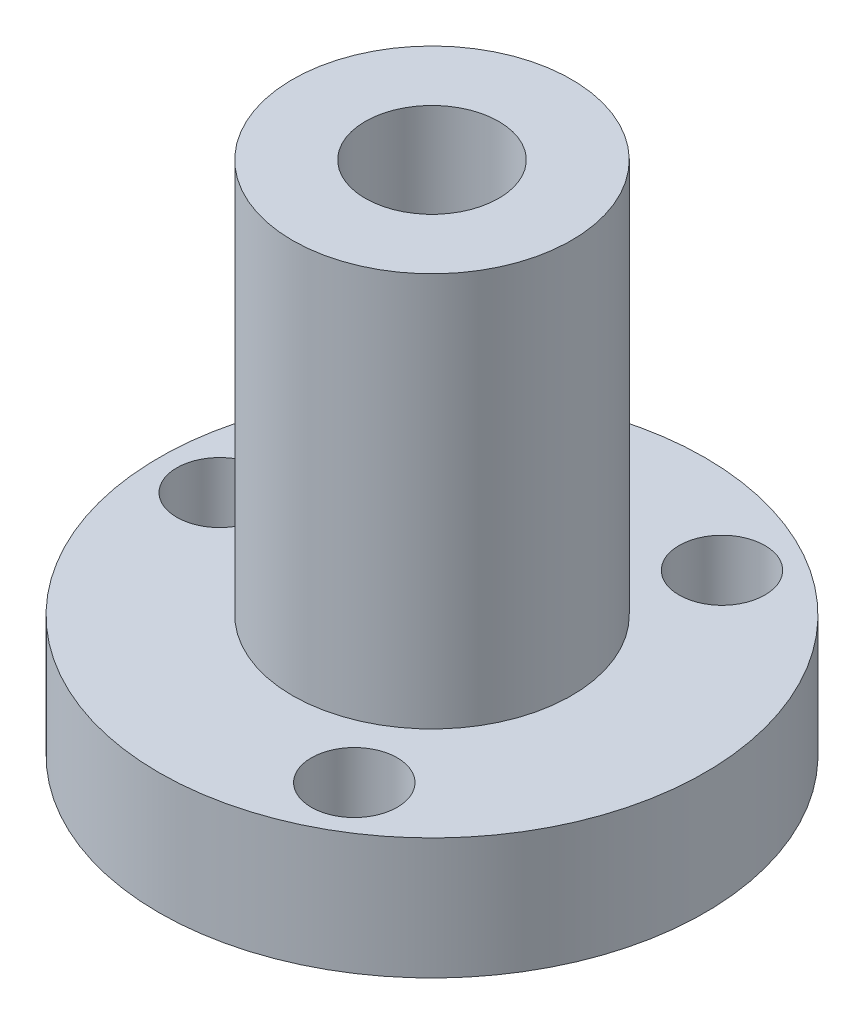
from build123d import *

# Parameters (mm, degrees)
SKETCH1_R             = 14.2875
BOSS_EXTRUDE1_DEPTH   = 6.35
SKETCH2_R             = 7.3025
BOSS_EXTRUDE2_DEPTH   = 20.6375
CUT_EXTRUDE1_REACH    = 35.713
SKETCH3_R             = 3.4925
F_8_CLEARANCE_HOLE1_D = 4.4958


with BuildPart() as part:
    # Sketch1 → Boss-Extrude1 (new body)
    with BuildSketch(Plane(origin=(0, 0, 0), x_dir=(1, 0, 0), z_dir=(0, 1, 0))):
        with Locations(Location((0, 0, 0), (0, 0, 270))):
            Circle(SKETCH1_R)
    extrude(amount=BOSS_EXTRUDE1_DEPTH)

    # Sketch2 → Boss-Extrude2 (add)
    with BuildSketch(Plane(origin=(0, 6.35, 0), x_dir=(1, 0, 0), z_dir=(0, 1, 0))):
        with Locations(Location((0, 0, 0), (0, 0, 270))):
            Circle(SKETCH2_R)
    extrude(amount=BOSS_EXTRUDE2_DEPTH)

    # Sketch3 → Cut-Extrude1 (cut, up to next)
    with BuildSketch(Plane.XZ, mode=Mode.PRIVATE) as cut_extrude1_sk1:
        with Locations(Location((0, 0, 0), (0, 0, 270))):
            Circle(SKETCH3_R)
    cut_extrude1_tool1 = extrude(cut_extrude1_sk1.sketch, amount=-CUT_EXTRUDE1_REACH, mode=Mode.PRIVATE) & part.part
    add(cut_extrude1_tool1.solids().sort_by_distance((0, 0, 0))[0], mode=Mode.SUBTRACT)

    # #8 Clearance Hole1 (through all)
    with Locations(Plane(origin=(0, 0, 0), x_dir=(-1, 0, 0), z_dir=(0, -1, 0))):
        with Locations((-5.55625, 9.6237073), (11.1125, 0), (-5.55625, -9.6237073)):
            Hole(F_8_CLEARANCE_HOLE1_D / 2)


solid = part.part
